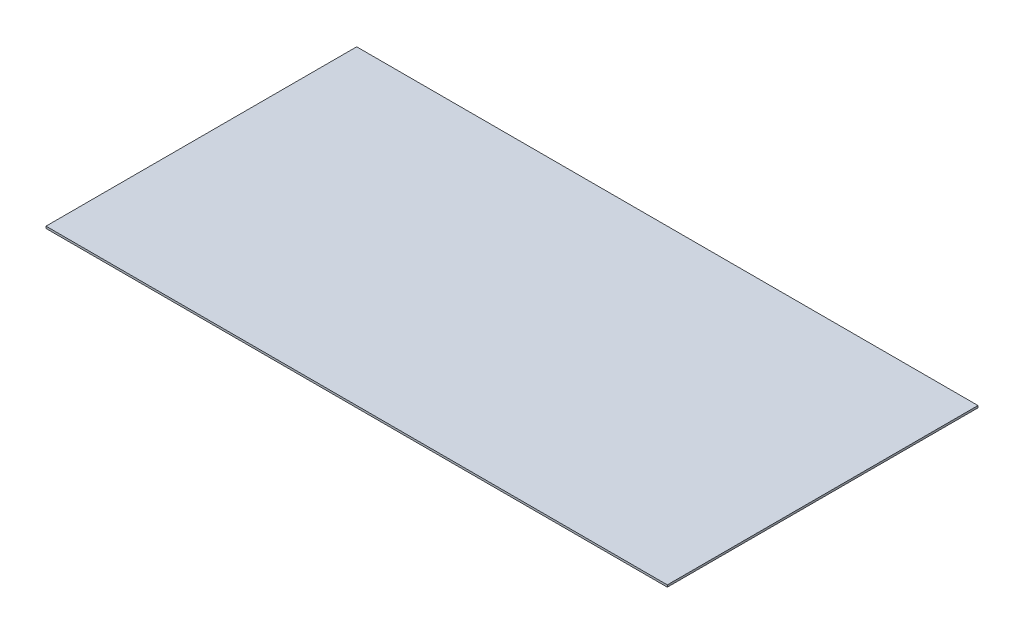
from build123d import *

# Parameters (mm, degrees)
SKETCH1_W           = 2438.4
SKETCH1_H           = 1219.2
BOSS_EXTRUDE1_DEPTH = 8


with BuildPart() as part:
    # Sketch1 → Boss-Extrude1 (new body)
    with BuildSketch(Plane(origin=(0, 0, 0), x_dir=(1, 0, 0), z_dir=(0, 1, 0))):
        Rectangle(SKETCH1_W, SKETCH1_H)
    extrude(amount=BOSS_EXTRUDE1_DEPTH)


solid = part.part
